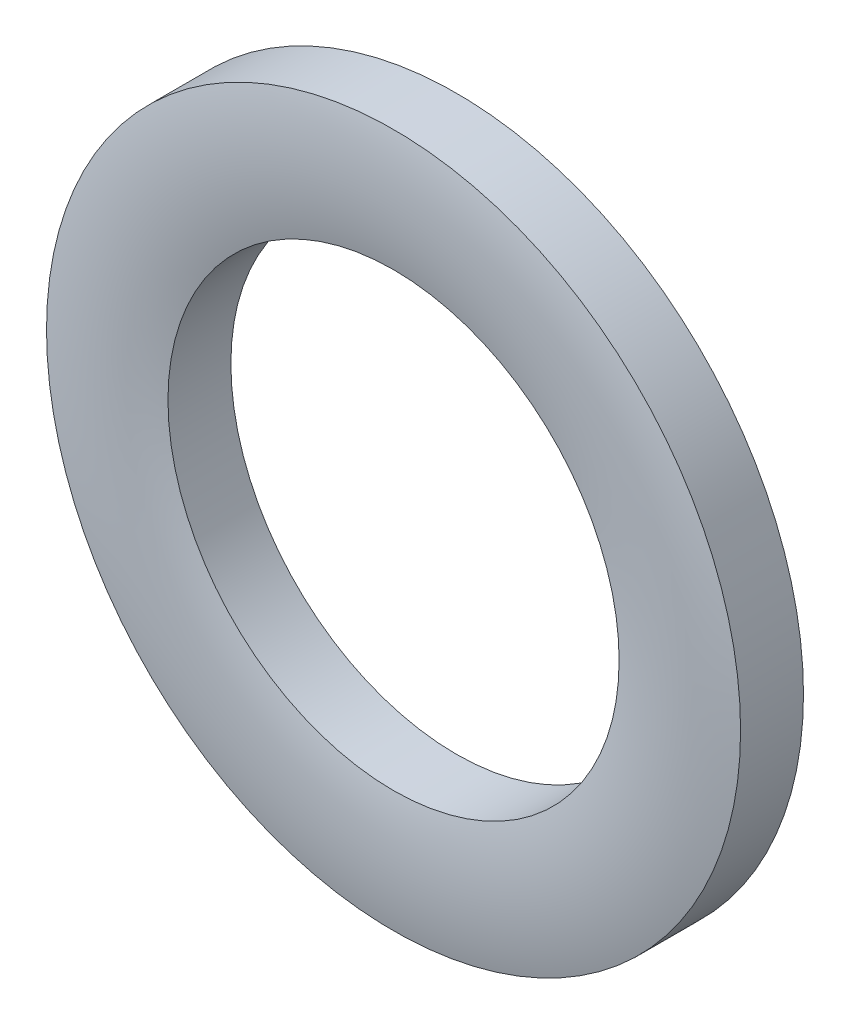
from build123d import *


with BuildPart() as part:
    # Sketch3 → Revolve1 (revolve)
    with BuildSketch(Plane(origin=(0, 0, 0), x_dir=(0, 0, -1), z_dir=(1, 0, 0)), mode=Mode.PRIVATE) as revolve1_sk:
        with BuildLine():
            Line((1, 10), (-0.8126, 10))
            ThreePointArc((-0.8126, 10), (-1, 8.25), (-0.8126, 6.5))
            Line((-0.8126, 6.5), (1, 6.5))
            Line((1, 6.5), (1, 10))
        make_face()
    revolve(revolve1_sk.sketch.rotate(Axis((0, 0, 1), (0, 0, -1)), 90), axis=Axis((0, 0, 1), (0, 0, -1)))


solid = part.part
